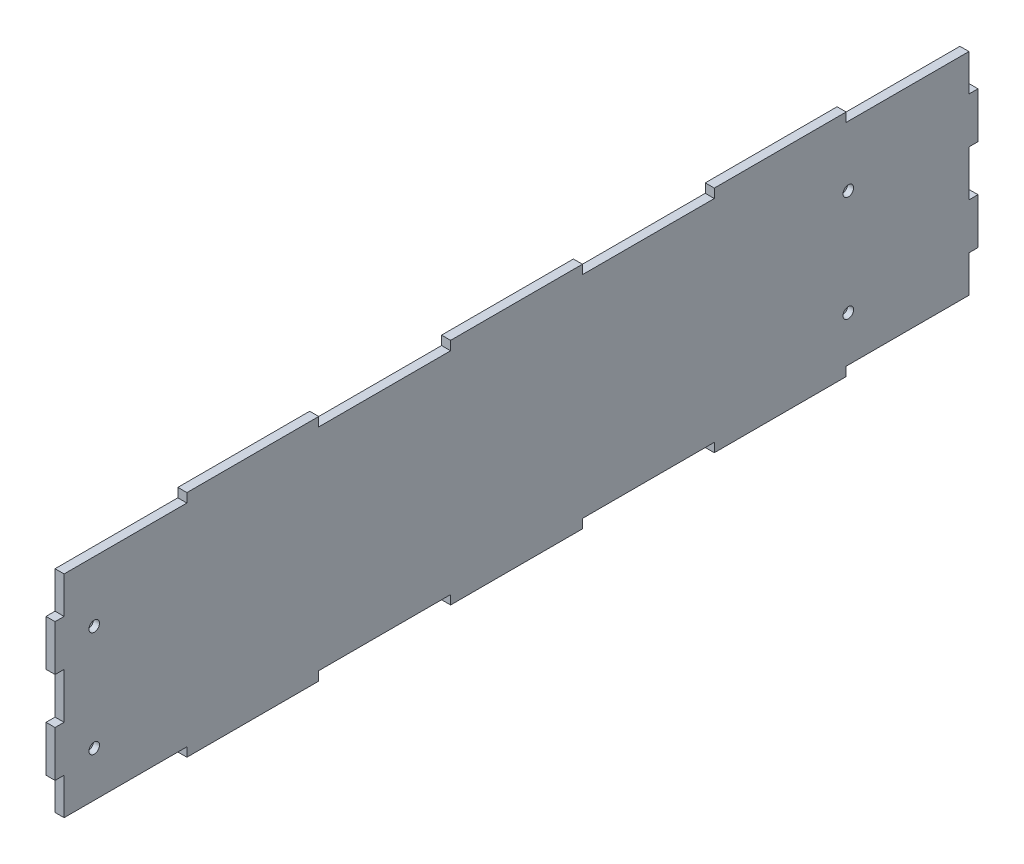
from build123d import *

# Parameters (mm, degrees)
BOSS_EXTRU_3_DEPTH                  = 3
DIAM_TRE_DU_PER_AGE_3_5_3_5_1_D     = 3.5
DIAM_TRE_DU_PER_AGE_3_5_3_5_1_DEPTH = 2
DIAM_TRE_DU_PER_AGE_3_5_3_5_1_TIP   = 1.051506083


with BuildPart() as part:
    # Esquisse3 → Boss.-Extru.3 (new body)
    with BuildSketch(Plane(origin=(0, 0, 0), x_dir=(0, 0, -1), z_dir=(1, 0, 0))):
        Polygon((109.285714286, 38), (65.571428571, 38), (65.571428571, 35), (21.857142857, 35), (21.857142857, 38), (-21.857142857, 38), (-21.857142857, 35), (-65.571428571, 35), (-65.571428571, 38), (-109.285714286, 38), (-109.285714286, 35), (-150, 35), (-150, 22.8), (-153, 22.8), (-153, 7.6), (-150, 7.6), (-150, -7.6), (-153, -7.6), (-153, -22.8), (-150, -22.8), (-150, -35), (-109.285714286, -35), (-109.285714286, -38), (-65.571428571, -38), (-65.571428571, -35), (-21.857142857, -35), (-21.857142857, -38), (21.857142857, -38), (21.857142857, -35), (65.571428571, -35), (65.571428571, -38), (109.285714286, -38), (109.285714286, -35), (150, -35), (150, -22.8), (153, -22.8), (153, -7.6), (150, -7.6), (150, 7.6), (153, 7.6), (153, 22.8), (150, 22.8), (150, 35), (109.285714286, 35), align=None)
    extrude(amount=BOSS_EXTRU_3_DEPTH)

    # Diamètre du perçage Ø3.5 (3.5)1
    with Locations(Plane(origin=(3, 0, 0), x_dir=(0, 0, -1), z_dir=(1, 0, 0))):
        with Locations((110, 15), (110, -20), (-140, 15), (-140, -20)):
            Hole(DIAM_TRE_DU_PER_AGE_3_5_3_5_1_D / 2, depth=DIAM_TRE_DU_PER_AGE_3_5_3_5_1_DEPTH)
            with Locations((0, 0, -(DIAM_TRE_DU_PER_AGE_3_5_3_5_1_DEPTH + DIAM_TRE_DU_PER_AGE_3_5_3_5_1_TIP / 2))):  # 118° drill point
                Cone(0, DIAM_TRE_DU_PER_AGE_3_5_3_5_1_D / 2, DIAM_TRE_DU_PER_AGE_3_5_3_5_1_TIP, mode=Mode.SUBTRACT)


solid = part.part
